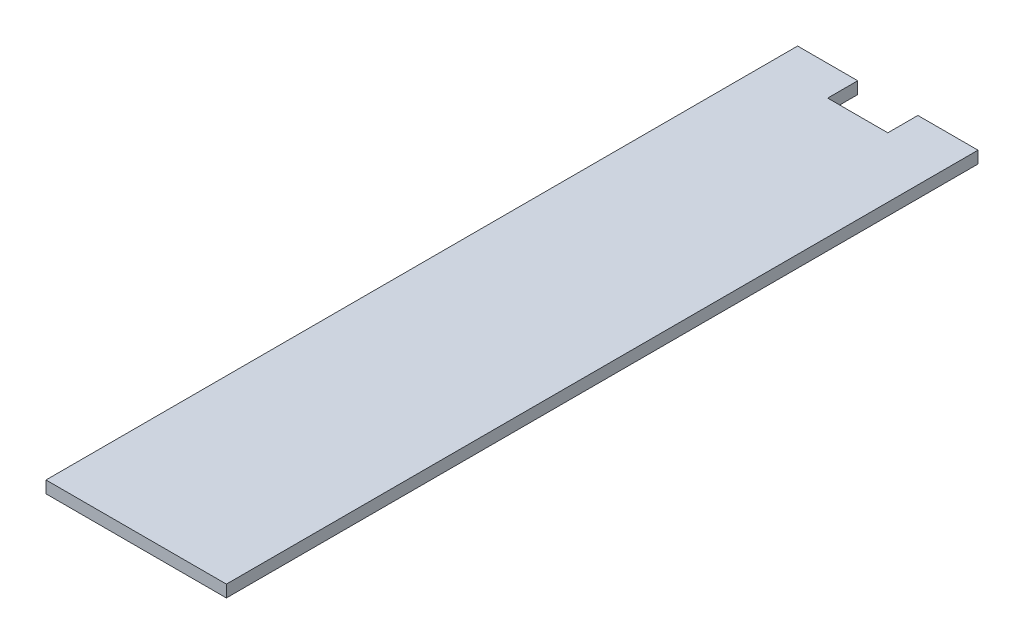
from build123d import *

# Parameters (mm, degrees)
SKETCH1_W           = 38.1
SKETCH1_H           = 152.4
SKETCH1_W_2         = 12.7
SKETCH1_H_2         = 6.35
BOSS_EXTRUDE1_DEPTH = 2.54


with BuildPart() as part:
    # Sketch1 → Boss-Extrude1 (new body)
    with BuildSketch(Plane(origin=(0, 0, 0), x_dir=(1, 0, 0), z_dir=(0, 1, 0))):
        with Locations((19.05, 76.2)):
            Rectangle(SKETCH1_W, SKETCH1_H)
        with Locations((6.35, 155.575)):
            Rectangle(SKETCH1_W_2, SKETCH1_H_2)
        with Locations((31.75, 155.575)):
            Rectangle(SKETCH1_W_2, SKETCH1_H_2)
    extrude(amount=BOSS_EXTRUDE1_DEPTH)


solid = part.part
